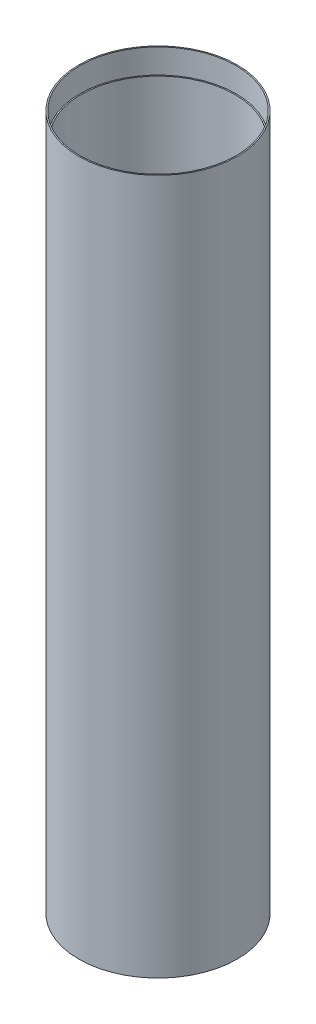
from build123d import *


with BuildPart() as part:
    # Szkic1 → Obrót1 (revolve)
    with BuildSketch(Plane.XY, mode=Mode.PRIVATE) as obr_t1_sk:
        Polygon((64, 285), (65, 285), (65, -285), (64, -285), (64, -265), (63, -265), (63, 265), (64, 265), align=None)
    revolve(obr_t1_sk.sketch.rotate(Axis((0, 0, 0), (0, 1, 0)), 90), axis=Axis((0, 0, 0), (0, 1, 0)))


solid = part.part
